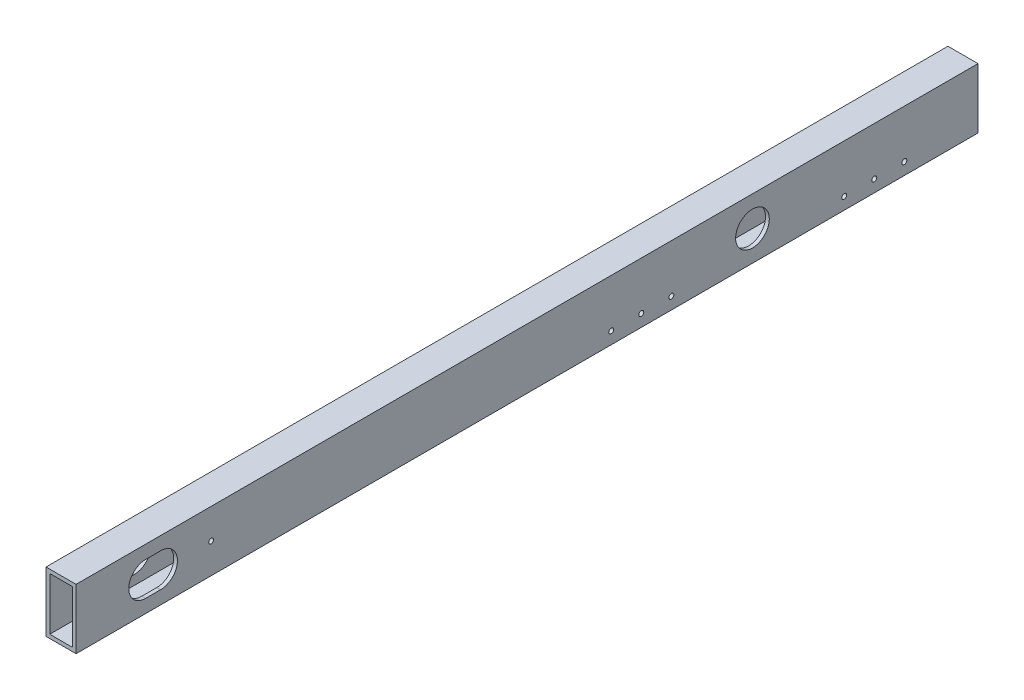
from build123d import *

# Parameters (mm, degrees)
SKETCH1_W           = 25.4
SKETCH1_H           = 50.8
SKETCH1_W_2         = 19.05
SKETCH1_H_2         = 44.45
BOSS_EXTRUDE1_DEPTH = 762
CUT_EXTRUDE1_REACH  = 764.846
SKETCH4_R           = 14.224
SKETCH4_R_2         = 2.032
SKETCH5_R           = 2.0955
CUT_EXTRUDE2_DEPTH  = 3.175
CUT_EXTRUDE3_REACH  = 764.846
SKETCH7_R           = 2.0955


with BuildPart() as part:
    # Sketch1 → Boss-Extrude1 (new body)
    with BuildSketch(Plane.XY):
        Rectangle(SKETCH1_W, SKETCH1_H)
        Rectangle(SKETCH1_W_2, SKETCH1_H_2, mode=Mode.SUBTRACT)
    extrude(amount=BOSS_EXTRUDE1_DEPTH)

    # Cut-Extrude1: up to this face of the body (flat: up to its plane)
    cut_extrude1_end = Plane(part.part.faces().sort_by_distance((-12.7, 0, 381))[0])
    # Sketch4 → Cut-Extrude1 (cut, up to the picked face)
    with BuildSketch(Plane(origin=(12.7, 0, 0), x_dir=(0, 0, -1), z_dir=(1, 0, 0)), mode=Mode.PRIVATE) as cut_extrude1_sk1:
        with Locations(Location((-190.549048411, 0, 0), (0, 0, 90))):
            Circle(SKETCH4_R)
    cut_extrude1_tool1 = split(extrude(cut_extrude1_sk1.sketch, amount=-CUT_EXTRUDE1_REACH, mode=Mode.PRIVATE), bisect_by=cut_extrude1_end, keep=Keep.BOTH, mode=Mode.PRIVATE)
    # Sketch4 → Cut-Extrude1 (cut, up to the picked face)
    with BuildSketch(Plane(origin=(12.7, 0, 0), x_dir=(0, 0, -1), z_dir=(1, 0, 0)), mode=Mode.PRIVATE) as cut_extrude1_sk2:
        with Locations(Location((-647.876048411, 0, 0), (0, 0, 90))):
            Circle(SKETCH4_R_2)
    cut_extrude1_tool2 = split(extrude(cut_extrude1_sk2.sketch, amount=-CUT_EXTRUDE1_REACH, mode=Mode.PRIVATE), bisect_by=cut_extrude1_end, keep=Keep.BOTH, mode=Mode.PRIVATE)
    # Sketch4 → Cut-Extrude1 (cut, up to the picked face)
    with BuildSketch(Plane(origin=(12.7, 0, 0), x_dir=(0, 0, -1), z_dir=(1, 0, 0)), mode=Mode.PRIVATE) as cut_extrude1_sk3:
        with BuildLine():
            Line((-703.248048411, 14.224), (-690.548048411, 14.224))
            ThreePointArc((-690.548048411, 14.224), (-676.324048411, 0), (-690.548048411, -14.224))
            Line((-690.548048411, -14.224), (-703.248048411, -14.224))
            ThreePointArc((-703.248048411, -14.224), (-717.472048411, 0), (-703.248048411, 14.224))
        make_face()
    cut_extrude1_tool3 = split(extrude(cut_extrude1_sk3.sketch, amount=-CUT_EXTRUDE1_REACH, mode=Mode.PRIVATE), bisect_by=cut_extrude1_end, keep=Keep.BOTH, mode=Mode.PRIVATE)
    add(cut_extrude1_tool1.solids().sort_by(Axis((12.7, 0, 190.549048), (-1, 0, 0)))[0], mode=Mode.SUBTRACT)
    add(cut_extrude1_tool2.solids().sort_by(Axis((12.7, 0, 647.876048), (-1, 0, 0)))[0], mode=Mode.SUBTRACT)
    add(cut_extrude1_tool3.solids().sort_by(Axis((12.7, 0, 696.898048), (-1, 0, 0)))[0], mode=Mode.SUBTRACT)

    # Sketch5 → Cut-Extrude2 (cut)
    with BuildSketch(Plane.XZ.offset(25.4)):
        with Locations(Location((2.54, 264.16, 0), (0, 0, 270))):
            Circle(SKETCH5_R)
        with Locations(Location((2.54, 289.56, 0), (0, 0, 270))):
            Circle(SKETCH5_R)
        with Locations(Location((2.54, 314.96, 0), (0, 0, 270))):
            Circle(SKETCH5_R)
        with Locations(Location((-2.54, 264.16, 0), (0, 0, 180))):
            Circle(SKETCH5_R)
        with Locations(Location((-2.54, 289.56, 0), (0, 0, 180))):
            Circle(SKETCH5_R)
        with Locations(Location((-2.54, 314.96, 0), (0, 0, 180))):
            Circle(SKETCH5_R)
    extrude(amount=-CUT_EXTRUDE2_DEPTH, mode=Mode.SUBTRACT)

    # Cut-Extrude3: up to this face of the body (flat: up to its plane)
    cut_extrude3_end = Plane(part.part.faces().sort_by_distance((-12.7, 0, 375.676024133))[0])
    # Sketch7 → Cut-Extrude3 (cut, up to the picked face)
    with BuildSketch(Plane(origin=(12.7, 0, 0), x_dir=(0, 0, -1), z_dir=(1, 0, 0)), mode=Mode.PRIVATE) as cut_extrude3_sk1:
        with Locations(Location((-259.08, -15.24, 0), (0, 0, 90))):
            Circle(SKETCH7_R)
    cut_extrude3_tool1 = split(extrude(cut_extrude3_sk1.sketch, amount=-CUT_EXTRUDE3_REACH, mode=Mode.PRIVATE), bisect_by=cut_extrude3_end, keep=Keep.BOTH, mode=Mode.PRIVATE)
    # Sketch7 → Cut-Extrude3 (cut, up to the picked face)
    with BuildSketch(Plane(origin=(12.7, 0, 0), x_dir=(0, 0, -1), z_dir=(1, 0, 0)), mode=Mode.PRIVATE) as cut_extrude3_sk2:
        with Locations(Location((-284.48, -15.24, 0), (0, 0, 90))):
            Circle(SKETCH7_R)
    cut_extrude3_tool2 = split(extrude(cut_extrude3_sk2.sketch, amount=-CUT_EXTRUDE3_REACH, mode=Mode.PRIVATE), bisect_by=cut_extrude3_end, keep=Keep.BOTH, mode=Mode.PRIVATE)
    # Sketch7 → Cut-Extrude3 (cut, up to the picked face)
    with BuildSketch(Plane(origin=(12.7, 0, 0), x_dir=(0, 0, -1), z_dir=(1, 0, 0)), mode=Mode.PRIVATE) as cut_extrude3_sk3:
        with Locations(Location((-309.88, -15.24, 0), (0, 0, 90))):
            Circle(SKETCH7_R)
    cut_extrude3_tool3 = split(extrude(cut_extrude3_sk3.sketch, amount=-CUT_EXTRUDE3_REACH, mode=Mode.PRIVATE), bisect_by=cut_extrude3_end, keep=Keep.BOTH, mode=Mode.PRIVATE)
    # Sketch7 → Cut-Extrude3 (cut, up to the picked face)
    with BuildSketch(Plane(origin=(12.7, 0, 0), x_dir=(0, 0, -1), z_dir=(1, 0, 0)), mode=Mode.PRIVATE) as cut_extrude3_sk4:
        with Locations(Location((-87.63, -15.24, 0), (0, 0, 90))):
            Circle(SKETCH7_R)
    cut_extrude3_tool4 = split(extrude(cut_extrude3_sk4.sketch, amount=-CUT_EXTRUDE3_REACH, mode=Mode.PRIVATE), bisect_by=cut_extrude3_end, keep=Keep.BOTH, mode=Mode.PRIVATE)
    # Sketch7 → Cut-Extrude3 (cut, up to the picked face)
    with BuildSketch(Plane(origin=(12.7, 0, 0), x_dir=(0, 0, -1), z_dir=(1, 0, 0)), mode=Mode.PRIVATE) as cut_extrude3_sk5:
        with Locations(Location((-62.23, -15.24, 0), (0, 0, 90))):
            Circle(SKETCH7_R)
    cut_extrude3_tool5 = split(extrude(cut_extrude3_sk5.sketch, amount=-CUT_EXTRUDE3_REACH, mode=Mode.PRIVATE), bisect_by=cut_extrude3_end, keep=Keep.BOTH, mode=Mode.PRIVATE)
    # Sketch7 → Cut-Extrude3 (cut, up to the picked face)
    with BuildSketch(Plane(origin=(12.7, 0, 0), x_dir=(0, 0, -1), z_dir=(1, 0, 0)), mode=Mode.PRIVATE) as cut_extrude3_sk6:
        with Locations(Location((-113.03, -15.24, 0), (0, 0, 90))):
            Circle(SKETCH7_R)
    cut_extrude3_tool6 = split(extrude(cut_extrude3_sk6.sketch, amount=-CUT_EXTRUDE3_REACH, mode=Mode.PRIVATE), bisect_by=cut_extrude3_end, keep=Keep.BOTH, mode=Mode.PRIVATE)
    add(cut_extrude3_tool1.solids().sort_by(Axis((12.7, -15.24, 259.08), (-1, 0, 0)))[0], mode=Mode.SUBTRACT)
    add(cut_extrude3_tool2.solids().sort_by(Axis((12.7, -15.24, 284.48), (-1, 0, 0)))[0], mode=Mode.SUBTRACT)
    add(cut_extrude3_tool3.solids().sort_by(Axis((12.7, -15.24, 309.88), (-1, 0, 0)))[0], mode=Mode.SUBTRACT)
    add(cut_extrude3_tool4.solids().sort_by(Axis((12.7, -15.24, 87.63), (-1, 0, 0)))[0], mode=Mode.SUBTRACT)
    add(cut_extrude3_tool5.solids().sort_by(Axis((12.7, -15.24, 62.23), (-1, 0, 0)))[0], mode=Mode.SUBTRACT)
    add(cut_extrude3_tool6.solids().sort_by(Axis((12.7, -15.24, 113.03), (-1, 0, 0)))[0], mode=Mode.SUBTRACT)


solid = part.part
